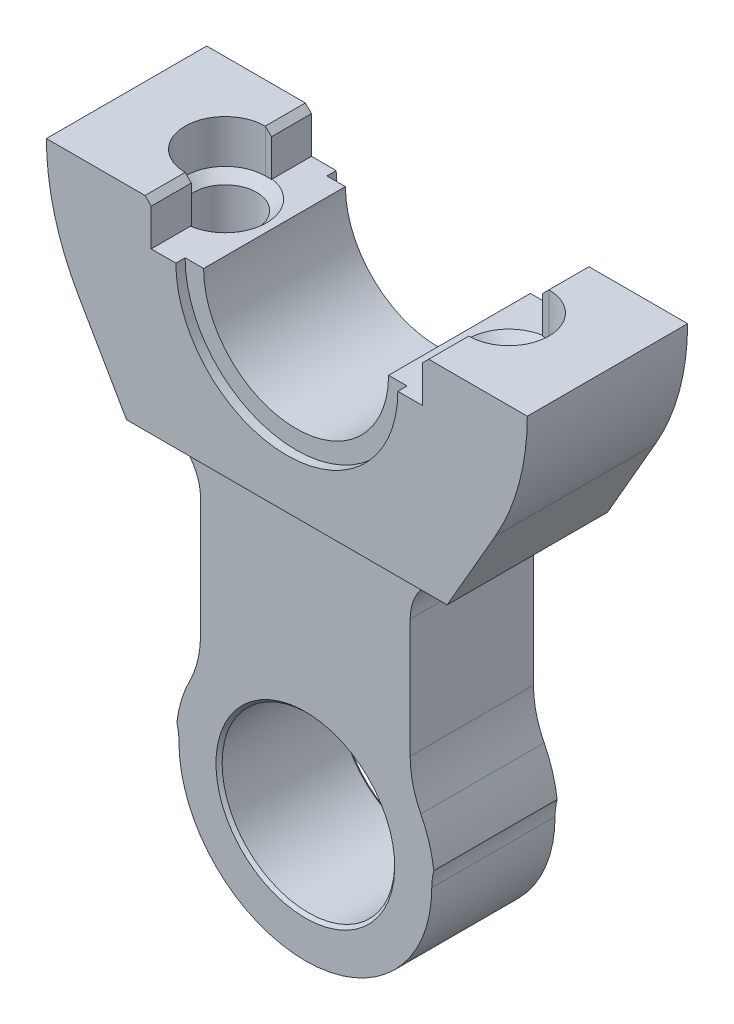
from build123d import *

# Parameters (mm, degrees)
SKETCH_1_R                  = 14
EXTRUDE_1_DEPTH             = 13
CUT_EXTRUDE_1_DEPTH         = 106.812333875
CUT_EXTRUDE_1_DEPTH_BACK    = 106.812333875
SKETCH_2_OUTSIDE_W          = 53.508
SKETCH_2_OUTSIDE_H          = 125.008
CUT_EXTRUDE_2_DEPTH         = 7
CHAMFER_1_SIZE              = 1
CHAMFER_2_SIZE              = 0.5
SKETCH_4_R                  = 18
CUT_EXTRUDE_3_DEPTH         = 1.5
HOLE_WIZARD_M121_AT_2_COUNT = 2
HOLE_WIZARD_M121_AT_2_PITCH = 46


with BuildPart() as part:
    # Эскиз1 → Бобышка-Вытянуть1 (new, symmetric)
    with BuildSketch(Plane.XY):
        with BuildLine():
            Line((33.795797544, -19.463917086), (26, -33))
            Line((26, -33), (25, -33))
            ThreePointArc((25, -33), (19.343145751, -35.343145751), (17, -41))
            Line((17, -41), (17, -60.266799469))
            ThreePointArc((17, -60.266799469), (17.438439597, -63.986723909), (18.72972973, -67.502778077))
            ThreePointArc((18.72972973, -67.502778077), (20.084453039, -70.866913818), (20.840163934, -74.413966902))
            ThreePointArc((20.840163934, -74.413966902), (20.58540569, -75.695845227), (20.5, -77))
            ThreePointArc((20.5, -77), (0, -97.5), (-20.5, -77))
            ThreePointArc((-20.5, -77), (-20.58540569, -75.695845227), (-20.840163934, -74.413966902))
            ThreePointArc((-20.840163934, -74.413966902), (-20.084453039, -70.866913818), (-18.72972973, -67.502778077))
            ThreePointArc((-18.72972973, -67.502778077), (-17.438439597, -63.986723909), (-17, -60.266799469))
            Line((-17, -60.266799469), (-17, -41))
            ThreePointArc((-17, -41), (-19.343145751, -35.343145751), (-25, -33))
            Line((-25, -33), (-26, -33))
            Line((-26, -33), (-33.795797544, -19.463917086))
            ThreePointArc((-33.795797544, -19.463917086), (-37.676492036, -10.073824889), (-39, 0))
            Line((-39, 0), (-22, 0))
            Line((-22, 0), (-22, -7))
            Line((-22, -7), (-15, -7))
            ThreePointArc((-15, -7), (0, -22), (15, -7))
            Line((15, -7), (22, -7))
            Line((22, -7), (22, 0))
            Line((22, 0), (39, 0))
            ThreePointArc((39, 0), (37.676492036, -10.073824889), (33.795797544, -19.463917086))
        make_face()
        with Locations(Location((0, -77, 0), (0, 0, 180))):
            Circle(SKETCH_1_R, mode=Mode.SUBTRACT)
    extrude(amount=EXTRUDE_1_DEPTH, both=True)

    # Эскиз2 outside → Вырез-Вытянуть1 (cut, two sides: drawn at the far end of the back side and taken through both)
    with BuildSketch(Plane(origin=(0, 0, 0), x_dir=(0, 0, -1), z_dir=(1, 0, 0)).offset(-CUT_EXTRUDE_1_DEPTH_BACK)):
        with Locations((0, -48.75)):
            Rectangle(SKETCH_2_OUTSIDE_W, SKETCH_2_OUTSIDE_H)
        with BuildLine():
            Line((13, 0), (-13, 0))
            Line((-13, 0), (-13, -33))
            Line((-13, -33), (-11.6, -33))
            ThreePointArc((-11.6, -33), (-10.46862915, -33.46862915), (-10, -34.6))
            Line((-10, -34.6), (-10, -97.5))
            Line((-10, -97.5), (10, -97.5))
            Line((10, -97.5), (10, -34.6))
            ThreePointArc((10, -34.6), (10.46862915, -33.46862915), (11.6, -33))
            Line((11.6, -33), (13, -33))
            Line((13, -33), (13, 0))
        make_face(mode=Mode.SUBTRACT)
    extrude(amount=CUT_EXTRUDE_1_DEPTH + CUT_EXTRUDE_1_DEPTH_BACK, mode=Mode.SUBTRACT)

    # Эскиз3 → Вырез-Вытянуть2 (cut)
    with BuildSketch(Plane(origin=(0, 0, 0), x_dir=(1, 0, 0), z_dir=(0, 1, 0))):
        with BuildLine():
            Line((23, 6.5), (22, 6.5))
            Line((22, 6.5), (22, -6.5))
            Line((22, -6.5), (23, -6.5))
            ThreePointArc((23, -6.5), (29.5, 0), (23, 6.5))
        make_face()
        with BuildLine():
            Line((-22, 6.5), (-22, -6.5))
            Line((-22, -6.5), (-23, -6.5))
            ThreePointArc((-23, -6.5), (-29.5, 0), (-23, 6.5))
            Line((-23, 6.5), (-22, 6.5))
        make_face()
    extrude(amount=-CUT_EXTRUDE_2_DEPTH, mode=Mode.SUBTRACT)

    # Фаска1
    chamfer_1_edges = [part.edges().sort_by_distance(p)[0] for p in [
        (22, 0, -9.75),
        (22, 0, 9.75),
        (-22, 0, 9.75),
        (-22, 0, -9.75),
    ]]
    chamfer(chamfer_1_edges, length=CHAMFER_1_SIZE)

    # Фаска2
    chamfer_2_edges = [part.edges().sort_by_distance(p)[0] for p in [
        (14, -77, -10),
        (14, -77, 10),
    ]]
    chamfer(chamfer_2_edges, length=CHAMFER_2_SIZE)

    # Эскиз4 → Вырез-Вытянуть3 (cut)
    with BuildSketch(Plane.XY.offset(13)):
        with Locations((0, -7)):
            Circle(SKETCH_4_R)
    cut_extrude_3 = extrude(amount=-CUT_EXTRUDE_3_DEPTH, mode=Mode.SUBTRACT)

    # Зеркальное отражение1: Вырез-Вытянуть3 across plane
    add(cut_extrude_3.mirror(Plane.XY), mode=Mode.SUBTRACT)

    # Эскиз6 → Отверстие обработанное метчиком M121 (revolve, cut)
    with BuildSketch(Plane(origin=(-23, -7, 0), x_dir=(0, 0, 1), z_dir=(1, 0, 0))):
        Polygon((0, 0), (0, 19.944486373), (5.1, 17), (5.1, 1.6), (6.7, 0), align=None)
    hole_wizard_m121 = revolve(axis=Axis((-23, -0.65, 0), (0, -1, 0)), mode=Mode.SUBTRACT)

    # Отверстие обработанное метчиком M121 at 2: Отверстие обработанное метчиком M121 ×2
    with Locations(*[(i * HOLE_WIZARD_M121_AT_2_PITCH, 0, 0) for i in range(1, HOLE_WIZARD_M121_AT_2_COUNT)]):
        add(hole_wizard_m121, mode=Mode.SUBTRACT)


solid = part.part
